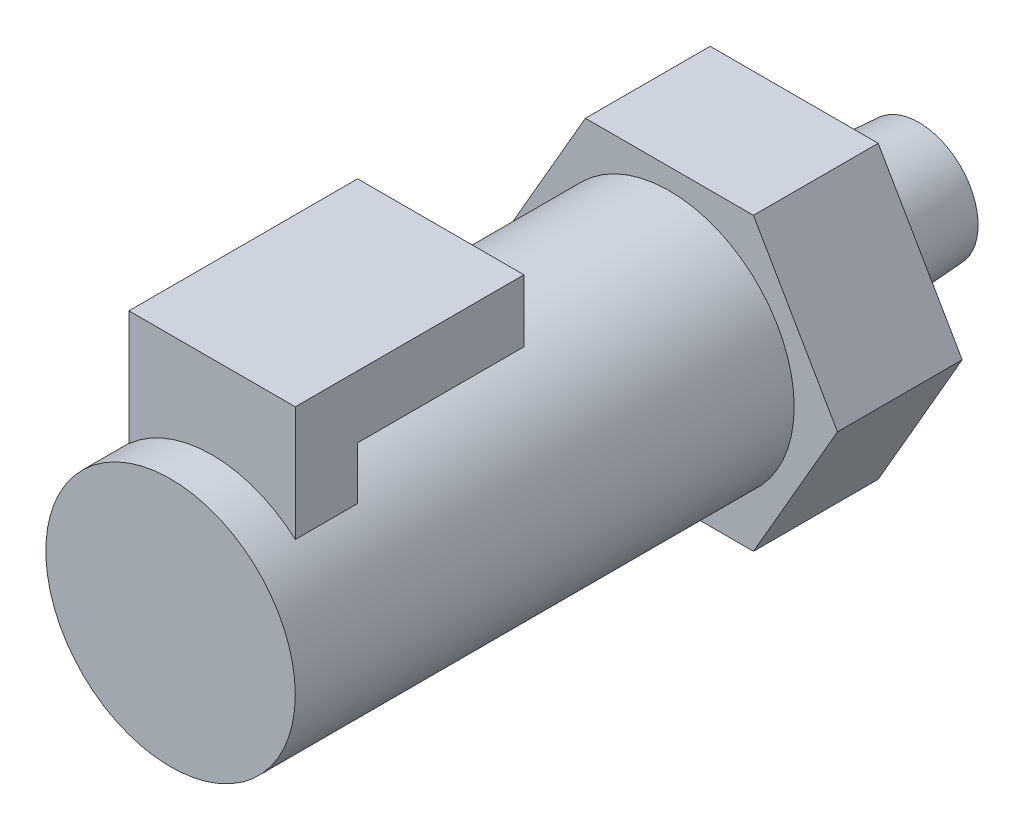
from build123d import *

# Parameters (mm, degrees)
BOSS_EXTRUDE1_DEPTH      = 9.525
SKETCH2_R                = 5.1054
BOSS_EXTRUDE2_DEPTH      = 9.525
BOSS_EXTRUDE2_TAPER      = 3.5
SKETCH3_R                = 9.525
BOSS_EXTRUDE3_DEPTH      = 38.1
BOSS_EXTRUDE5_DEPTH      = 6.35
BOSS_EXTRUDE5_DEPTH_BACK = 9.525
SKETCH5_W                = 12.7
SKETCH5_H                = 4.7625
SKETCH6_W                = 12.7
SKETCH6_H                = 4.7625
BOSS_EXTRUDE6_DEPTH      = 12.7


with BuildPart() as part:
    # Sketch1 → Boss-Extrude1 (new body)
    with BuildSketch(Plane.XY):
        Polygon((6.415804866, 11.1125), (-6.415804866, 11.1125), (-12.831609733, 0), (-6.415804866, -11.1125), (6.415804866, -11.1125), (12.831609733, 0), align=None)
    extrude(amount=BOSS_EXTRUDE1_DEPTH)

    # Sketch2 → Boss-Extrude2 (add)
    with BuildSketch(Plane(origin=(0, 0, 0), x_dir=(-1, 0, 0), z_dir=(0, 0, -1))):
        Circle(SKETCH2_R)
    extrude(amount=BOSS_EXTRUDE2_DEPTH, taper=BOSS_EXTRUDE2_TAPER)

    # Sketch3 → Boss-Extrude3 (add)
    with BuildSketch(Plane.XY.offset(9.525)):
        with Locations(Location((0, 0, 0), (0, 0, 180))):
            Circle(SKETCH3_R)
    extrude(amount=BOSS_EXTRUDE3_DEPTH)

    # Sketch5 → Boss-Extrude5 (add, two sides: drawn at the far end of the back side and taken through both)
    with BuildSketch(Plane(origin=(0, 9.525, 0), x_dir=(1, 0, 0), z_dir=(0, 1, 0)).offset(-BOSS_EXTRUDE5_DEPTH_BACK)):
        with Locations((0, -42.06875)):
            Rectangle(SKETCH5_W, SKETCH5_H)
    extrude(amount=BOSS_EXTRUDE5_DEPTH + BOSS_EXTRUDE5_DEPTH_BACK)

    # Sketch6 → Boss-Extrude6 (add)
    with BuildSketch(Plane(origin=(0, 0, 39.6875), x_dir=(-1, 0, 0), z_dir=(0, 0, -1))):
        with Locations((0, 13.49375)):
            Rectangle(SKETCH6_W, SKETCH6_H)
    extrude(amount=BOSS_EXTRUDE6_DEPTH)


solid = part.part
